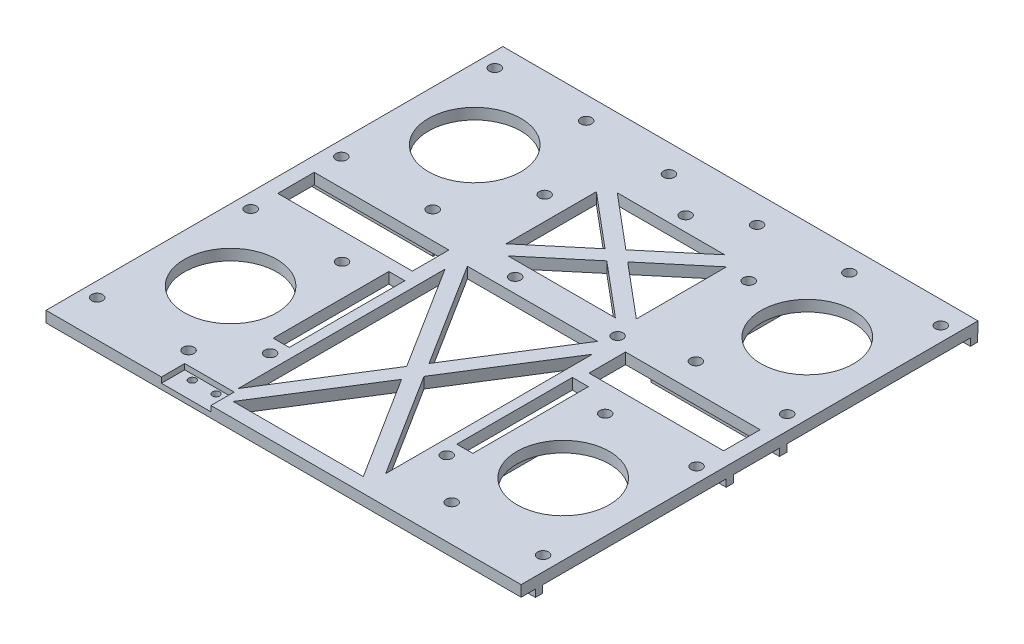
from build123d import *

# Parameters (mm, degrees)
SKETCH1_W                 = 130
SKETCH1_H                 = 125
BOSS_EXTRUDE1_DEPTH       = 5
SKETCH2_R                 = 1.5
SKETCH2_R_2               = 12.65
CUT_EXTRUDE1_DEPTH        = 10
SKETCH4_R                 = 1.5
CUT_EXTRUDE3_DEPTH        = 10
BOSS_EXTRUDE2_DEPTH       = 2
MIRROR7_COPY_1_SKETCH_R   = 1.5
MIRROR7_COPY_1_SKETCH_R_2 = 12.65
MIRROR7_COPY_1_DEPTH      = 10
MIRROR7_COPY_2_DEPTH      = 2
SKETCH10_R                = 1.5
CUT_EXTRUDE8_DEPTH        = 91.311959341
SKETCH11_R                = 2.65
CUT_EXTRUDE9_DEPTH        = 0.5
CUT_EXTRUDE10_DEPTH       = 91.444734507
CUT_EXTRUDE11_DEPTH       = 91.444734507
CUT_EXTRUDE12_DEPTH       = 91.444734507
SKETCH15_W                = 130
SKETCH15_H                = 125
SKETCH15_W_2              = 5
SKETCH15_H_2              = 5
CUT_EXTRUDE14_DEPTH       = 2
CUT_EXTRUDE15_START       = -8
SKETCH17_W                = 137.629855092
SKETCH17_H                = 131.076052468
CUT_EXTRUDE15_DEPTH       = 2
SKETCH18_W                = 13.527386212
SKETCH18_H                = 6.370278614
CUT_EXTRUDE16_DEPTH       = 1.5
SKETCH19_R                = 1
CUT_EXTRUDE17_DEPTH       = 5
SKETCH20_W                = 6.657761804
SKETCH20_H                = 4.4233075
CUT_EXTRUDE18_DEPTH       = 2
SKETCH21_W                = 4.376485765
SKETCH21_H                = 31.63
SKETCH21_W_2              = 4.3838
CUT_EXTRUDE19_DEPTH       = 7.4


with BuildPart() as part:
    # Sketch1 → Boss-Extrude1 (new body)
    with BuildSketch(Plane(origin=(0, 0, 0), x_dir=(1, 0, 0), z_dir=(0, 1, 0))):
        Rectangle(SKETCH1_W, SKETCH1_H)
    extrude(amount=BOSS_EXTRUDE1_DEPTH)

    # Sketch2 → Cut-Extrude1 (cut)
    with BuildSketch(Plane(origin=(0, 5, 0), x_dir=(1, 0, 0), z_dir=(0, 1, 0))):
        with Locations(Location((-61, -52.5, 0), (0, 0, 270))):
            Circle(SKETCH2_R)
        with Locations(Location((-36, -52.5, 0), (0, 0, 270))):
            Circle(SKETCH2_R)
        with Locations(Location((-36, -10.5, 0), (0, 0, 270))):
            Circle(SKETCH2_R)
        with Locations(Location((-61, -10.5, 0), (0, 0, 270))):
            Circle(SKETCH2_R)
        with Locations(Location((-45.5, -31.5, 0), (0, 0, 270))):
            Circle(SKETCH2_R_2)
    cut_extrude1 = extrude(amount=-CUT_EXTRUDE1_DEPTH, mode=Mode.SUBTRACT)

    # Mirror3: Cut-Extrude1 across plane
    add(cut_extrude1.mirror(Plane.ZY), mode=Mode.SUBTRACT)

    # Sketch4 → Cut-Extrude3 (cut)
    with BuildSketch(Plane(origin=(0, 5, 0), x_dir=(1, 0, 0), z_dir=(0, 1, 0))):
        with Locations(Location((0, 47.5, 0), (0, 0, 270))):
            Circle(SKETCH4_R)
        with Locations(Location((12.049810205, 55, 0), (0, 0, 270))):
            Circle(SKETCH4_R)
        with Locations(Location((-12.049810205, 55, 0), (0, 0, 270))):
            Circle(SKETCH4_R)
    extrude(amount=-CUT_EXTRUDE3_DEPTH, mode=Mode.SUBTRACT)

    # Sketch5 → Boss-Extrude2 (add)
    with BuildSketch(Plane.XZ):
        Polygon((-65, 58.6), (-65, 56.6), (-31.8, 56.6), (-31.8, 6.4), (-65, 6.4), (-65, 4.4), (-29.8, 4.4), (-29.8, 58.6), align=None)
    boss_extrude2 = extrude(amount=BOSS_EXTRUDE2_DEPTH)

    # Mirror5: Boss-Extrude2 across plane
    add(boss_extrude2.mirror(Plane.ZY))

    # Mirror7: Cut-Extrude1, Boss-Extrude2 across plane
    add(cut_extrude1.mirror(Plane.XY.offset(-1.9)), mode=Mode.SUBTRACT)
    add(boss_extrude2.mirror(Plane.XY.offset(-1.9)))

    # Mirror7 copy 1 sketch → Mirror7 copy 1 (cut)
    with BuildSketch(Plane(origin=(0, 5, -3.8), x_dir=(-1, 0, 0), z_dir=(0, 1, 0))):
        with Locations(Location((-61, -52.5, 0), (0, 0, 270))):
            Circle(MIRROR7_COPY_1_SKETCH_R)
        with Locations(Location((-36, -52.5, 0), (0, 0, 270))):
            Circle(MIRROR7_COPY_1_SKETCH_R)
        with Locations(Location((-36, -10.5, 0), (0, 0, 270))):
            Circle(MIRROR7_COPY_1_SKETCH_R)
        with Locations(Location((-61, -10.5, 0), (0, 0, 270))):
            Circle(MIRROR7_COPY_1_SKETCH_R)
        with Locations(Location((-45.5, -31.5, 0), (0, 0, 270))):
            Circle(MIRROR7_COPY_1_SKETCH_R_2)
    extrude(amount=-MIRROR7_COPY_1_DEPTH, mode=Mode.SUBTRACT)

    # Mirror7 copy 2 sketch → Mirror7 copy 2 (add)
    with BuildSketch(Plane(origin=(0, 0, -3.8), x_dir=(-1, 0, 0), z_dir=(0, -1, 0))):
        Polygon((-65, 58.6), (-65, 56.6), (-31.8, 56.6), (-31.8, 6.4), (-65, 6.4), (-65, 4.4), (-29.8, 4.4), (-29.8, 58.6), align=None)
    extrude(amount=MIRROR7_COPY_2_DEPTH)

    # Sketch10 → Cut-Extrude8 (cut, through all)
    with BuildSketch(Plane(origin=(0, 0, 0), x_dir=(-1, 0, 0), z_dir=(0, -1, 0))):
        with Locations(Location((-24.17, -42.03, 0), (0, 0, 90))):
            Circle(SKETCH10_R)
        with Locations(Location((24.1662, -42.03, 0), (0, 0, 90))):
            Circle(SKETCH10_R)
        with Locations(Location((-19.291507234, 9.5955, 0), (0, 0, 90))):
            Circle(SKETCH10_R)
        with Locations(Location((8.724692766, 9.5955, 0), (0, 0, 90))):
            Circle(SKETCH10_R)
        with Locations(Location((-24.17, 40.5962, 0), (0, 0, 90))):
            Circle(SKETCH10_R)
        with Locations(Location((24.1662, 33.1032, 0), (0, 0, 90))):
            Circle(SKETCH10_R)
    extrude(amount=-CUT_EXTRUDE8_DEPTH, mode=Mode.SUBTRACT)

    # Sketch11 → Cut-Extrude9 (cut)
    with BuildSketch(Plane.XZ):
        with Locations(Location((-12.049810205, -55, 0), (0, 0, 270))):
            Circle(SKETCH11_R)
        with Locations(Location((0, -47.5, 0), (0, 0, 270))):
            Circle(SKETCH11_R)
        with Locations(Location((12.049810205, -55, 0), (0, 0, 270))):
            Circle(SKETCH11_R)
        with Locations(Location((-24.1662, -33.1032, 0), (0, 0, 270))):
            Circle(SKETCH11_R)
        with Locations(Location((24.17, -40.5962, 0), (0, 0, 270))):
            Circle(SKETCH11_R)
        with Locations(Location((19.291507234, -9.5955, 0), (0, 0, 270))):
            Circle(SKETCH11_R)
        with Locations(Location((-8.724692766, -9.5955, 0), (0, 0, 270))):
            Circle(SKETCH11_R)
        with Locations(Location((-24.1662, 42.03, 0), (0, 0, 270))):
            Circle(SKETCH11_R)
        with Locations(Location((24.17, 42.03, 0), (0, 0, 270))):
            Circle(SKETCH11_R)
        with Locations(Location((-61, -14.3, 0), (0, 0, 270))):
            Circle(SKETCH11_R)
        with Locations(Location((-36, -14.3, 0), (0, 0, 270))):
            Circle(SKETCH11_R)
        with Locations(Location((-61, -56.3, 0), (0, 0, 270))):
            Circle(SKETCH11_R)
        with Locations(Location((-36, -56.3, 0), (0, 0, 270))):
            Circle(SKETCH11_R)
        with Locations(Location((36, -56.3, 0), (0, 0, 270))):
            Circle(SKETCH11_R)
        with Locations(Location((61, -56.3, 0), (0, 0, 270))):
            Circle(SKETCH11_R)
        with Locations(Location((36, -14.3, 0), (0, 0, 270))):
            Circle(SKETCH11_R)
        with Locations(Location((61, -14.3, 0), (0, 0, 270))):
            Circle(SKETCH11_R)
        with Locations(Location((36, 10.5, 0), (0, 0, 270))):
            Circle(SKETCH11_R)
        with Locations(Location((61, 10.5, 0), (0, 0, 270))):
            Circle(SKETCH11_R)
        with Locations(Location((61, 52.5, 0), (0, 0, 270))):
            Circle(SKETCH11_R)
        with Locations(Location((36, 52.5, 0), (0, 0, 270))):
            Circle(SKETCH11_R)
        with Locations(Location((-36, 52.5, 0), (0, 0, 270))):
            Circle(SKETCH11_R)
        with Locations(Location((-36, 10.5, 0), (0, 0, 270))):
            Circle(SKETCH11_R)
        with Locations(Location((-61, 10.5, 0), (0, 0, 270))):
            Circle(SKETCH11_R)
        with Locations(Location((-61, 52.5, 0), (0, 0, 270))):
            Circle(SKETCH11_R)
    extrude(amount=-CUT_EXTRUDE9_DEPTH, mode=Mode.SUBTRACT)

    # Sketch12 → Cut-Extrude10 (cut, through all)
    with BuildSketch(Plane(origin=(0, 5, 0), x_dir=(1, 0, 0), z_dir=(0, 1, 0))):
        Polygon((-2.361179516, -26.45225), (-20.1662, 1.840491767), (-20.1662, -54.744991767), align=None)
        Polygon((17.806920484, 5.5955), (-17.803120484, 5.5955), (0.0019, -22.697241767), align=None)
        Polygon((20.17, -54.744991767), (20.17, 1.840491767), (2.364979516, -26.45225), align=None)
        Polygon((0.0019, -30.207258233), (-17.803120484, -58.5), (17.806920484, -58.5), align=None)
    extrude(amount=-CUT_EXTRUDE10_DEPTH, mode=Mode.SUBTRACT)

    # Sketch13 → Cut-Extrude11 (cut, through all)
    with BuildSketch(Plane(origin=(0, 5, 0), x_dir=(1, 0, 0), z_dir=(0, 1, 0))):
        Polygon((-61, 1.9), (-61, -3.1), (-24.1662, -3.1), (-24.1662, 6.9), (-61, 6.9), align=None)
    cut_extrude11 = extrude(amount=-CUT_EXTRUDE11_DEPTH, mode=Mode.SUBTRACT)

    # Mirror9: Cut-Extrude11 across plane
    add(cut_extrude11.mirror(Plane.ZY), mode=Mode.SUBTRACT)

    # Sketch14 → Cut-Extrude12 (cut, through all)
    with BuildSketch(Plane(origin=(0, 5, 0), x_dir=(1, 0, 0), z_dir=(0, 1, 0))):
        Polygon((-3.108074736, 28.54775), (-17.803120484, 40.888314167), (-17.803120484, 16.207185833), align=None)
        Polygon((14.696945748, 43.5), (-14.693145748, 43.5), (0.0019, 31.159435833), align=None)
        Polygon((17.806920484, 16.207185833), (17.806920484, 40.888314167), (3.111874736, 28.54775), align=None)
        Polygon((0.0019, 25.936064167), (-14.693145748, 13.5955), (14.696945748, 13.5955), align=None)
    extrude(amount=-CUT_EXTRUDE12_DEPTH, mode=Mode.SUBTRACT)

    # Sketch15 → Cut-Extrude14 (cut)
    with BuildSketch(Plane(origin=(0, 5, 0), x_dir=(1, 0, 0), z_dir=(0, 1, 0))):
        Rectangle(SKETCH15_W, SKETCH15_H)
        with Locations((-61, 56.3)):
            Rectangle(SKETCH15_W_2, SKETCH15_H_2, mode=Mode.SUBTRACT)
        with Locations((-36, 56.3)):
            Rectangle(SKETCH15_W_2, SKETCH15_H_2, mode=Mode.SUBTRACT)
        with Locations((-12.049810205, 55)):
            Rectangle(SKETCH15_W_2, SKETCH15_H_2, mode=Mode.SUBTRACT)
        with Locations((0, 47.5)):
            Rectangle(SKETCH15_W_2, SKETCH15_H_2, mode=Mode.SUBTRACT)
        with Locations((12.049810205, 55)):
            Rectangle(SKETCH15_W_2, SKETCH15_H_2, mode=Mode.SUBTRACT)
        with Locations((36, 56.3)):
            Rectangle(SKETCH15_W_2, SKETCH15_H_2, mode=Mode.SUBTRACT)
        with Locations((61, 56.3)):
            Rectangle(SKETCH15_W_2, SKETCH15_H_2, mode=Mode.SUBTRACT)
        with Locations((36, 14.3)):
            Rectangle(SKETCH15_W_2, SKETCH15_H_2, mode=Mode.SUBTRACT)
        with Locations((61, 14.3)):
            Rectangle(SKETCH15_W_2, SKETCH15_H_2, mode=Mode.SUBTRACT)
        with Locations((24.17, 40.5962)):
            Rectangle(SKETCH15_W_2, SKETCH15_H_2, mode=Mode.SUBTRACT)
        with Locations((36, -10.5)):
            Rectangle(SKETCH15_W_2, SKETCH15_H_2, mode=Mode.SUBTRACT)
        with Locations((61, -10.5)):
            Rectangle(SKETCH15_W_2, SKETCH15_H_2, mode=Mode.SUBTRACT)
        with Locations((24.17, -42.03)):
            Rectangle(SKETCH15_W_2, SKETCH15_H_2, mode=Mode.SUBTRACT)
        with Locations((36, -52.5)):
            Rectangle(SKETCH15_W_2, SKETCH15_H_2, mode=Mode.SUBTRACT)
        with Locations((61, -52.5)):
            Rectangle(SKETCH15_W_2, SKETCH15_H_2, mode=Mode.SUBTRACT)
        with Locations((-24.1662, -42.03)):
            Rectangle(SKETCH15_W_2, SKETCH15_H_2, mode=Mode.SUBTRACT)
        with Locations((-36, -52.5)):
            Rectangle(SKETCH15_W_2, SKETCH15_H_2, mode=Mode.SUBTRACT)
        with Locations((-36, -10.5)):
            Rectangle(SKETCH15_W_2, SKETCH15_H_2, mode=Mode.SUBTRACT)
        with Locations((19.291507234, 9.5955)):
            Rectangle(SKETCH15_W_2, SKETCH15_H_2, mode=Mode.SUBTRACT)
        with Locations((-8.724692766, 9.5955)):
            Rectangle(SKETCH15_W_2, SKETCH15_H_2, mode=Mode.SUBTRACT)
        with Locations((-24.1662, 33.1032)):
            Rectangle(SKETCH15_W_2, SKETCH15_H_2, mode=Mode.SUBTRACT)
        with Locations((-61, 14.3)):
            Rectangle(SKETCH15_W_2, SKETCH15_H_2, mode=Mode.SUBTRACT)
        with Locations((-36, 14.3)):
            Rectangle(SKETCH15_W_2, SKETCH15_H_2, mode=Mode.SUBTRACT)
        with Locations((-61, -10.5)):
            Rectangle(SKETCH15_W_2, SKETCH15_H_2, mode=Mode.SUBTRACT)
        with Locations((-61, -52.5)):
            Rectangle(SKETCH15_W_2, SKETCH15_H_2, mode=Mode.SUBTRACT)
    extrude(amount=-CUT_EXTRUDE14_DEPTH, mode=Mode.SUBTRACT)

    # Sketch17 → Cut-Extrude15 (cut)
    with BuildSketch(Plane(origin=(0, 13, 0), x_dir=(1, 0, 0), z_dir=(0, 1, 0)).offset(CUT_EXTRUDE15_START)):
        with Locations((0.756207995, -1.260346658)):
            Rectangle(SKETCH17_W, SKETCH17_H)
    extrude(amount=-CUT_EXTRUDE15_DEPTH, mode=Mode.SUBTRACT)

    # Sketch18 → Cut-Extrude16 (cut)
    with BuildSketch(Plane(origin=(0, 3, 0), x_dir=(1, 0, 0), z_dir=(0, 1, 0))):
        with Locations((-26.648289701, -59.314860693)):
            Rectangle(SKETCH18_W, SKETCH18_H)
    extrude(amount=-CUT_EXTRUDE16_DEPTH, mode=Mode.SUBTRACT)

    # Sketch19 → Cut-Extrude17 (cut)
    with BuildSketch(Plane(origin=(0, 1.5, 0), x_dir=(1, 0, 0), z_dir=(0, 1, 0))):
        with Locations(Location((-23.4163, -57.55, 0), (0, 0, 270))):
            Circle(SKETCH19_R)
        with Locations(Location((-29.9163, -57.55, 0), (0, 0, 270))):
            Circle(SKETCH19_R)
    extrude(amount=-CUT_EXTRUDE17_DEPTH, mode=Mode.SUBTRACT)

    # Sketch20 → Cut-Extrude18 (cut)
    with BuildSketch(Plane.XZ):
        with Locations((-29.482363252, 57.493891291)):
            Rectangle(SKETCH20_W, SKETCH20_H)
    extrude(amount=CUT_EXTRUDE18_DEPTH, mode=Mode.SUBTRACT)

    # Sketch21 → Cut-Extrude19 (cut)
    with BuildSketch(Plane(origin=(0, 0, 0), x_dir=(-1, 0, 0), z_dir=(0, -1, 0))):
        with Locations((-25.111757118, -22.215)):
            Rectangle(SKETCH21_W, SKETCH21_H)
        with Locations((25.1081, -22.215)):
            Rectangle(SKETCH21_W_2, SKETCH21_H)
    extrude(amount=-CUT_EXTRUDE19_DEPTH, mode=Mode.SUBTRACT)


solid = part.part
